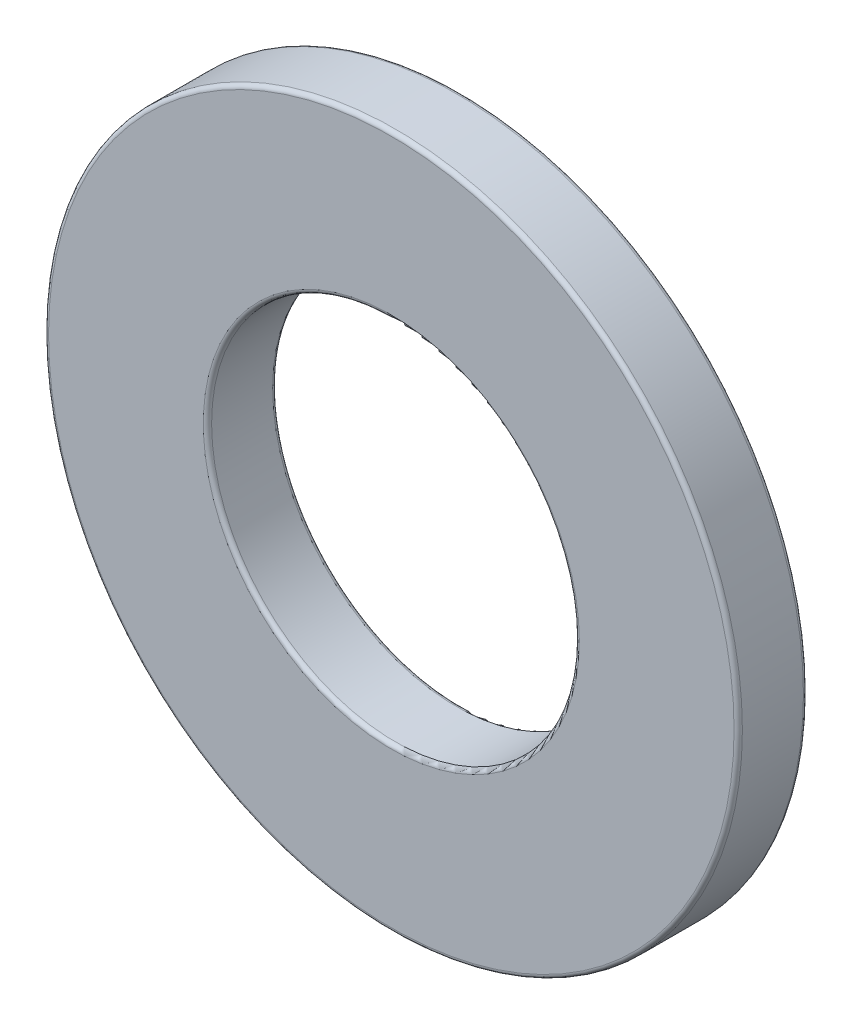
from build123d import *

# Parameters (mm, degrees)
BOSS_EXTRUDE1_START = 0.5
SKETCH3_R           = 5
SKETCH3_R_2         = 2.65
BOSS_EXTRUDE1_DEPTH = 1
FILLET1_R           = 0.06


with BuildPart() as part:
    # Sketch3 → Boss-Extrude1 (new body)
    with BuildSketch(Plane.XY.offset(BOSS_EXTRUDE1_START)):
        Circle(SKETCH3_R)
        Circle(SKETCH3_R_2, mode=Mode.SUBTRACT)
    extrude(amount=-BOSS_EXTRUDE1_DEPTH)

    # Fillet1
    fillet1_edges = [part.edges().sort_by_distance(p)[0] for p in [
        (-5, 0, 0.5),
        (-5, 0, -0.5),
        (-2.65, 0, -0.5),
        (-2.65, 0, 0.5),
    ]]
    fillet(fillet1_edges, radius=FILLET1_R)


solid = part.part
